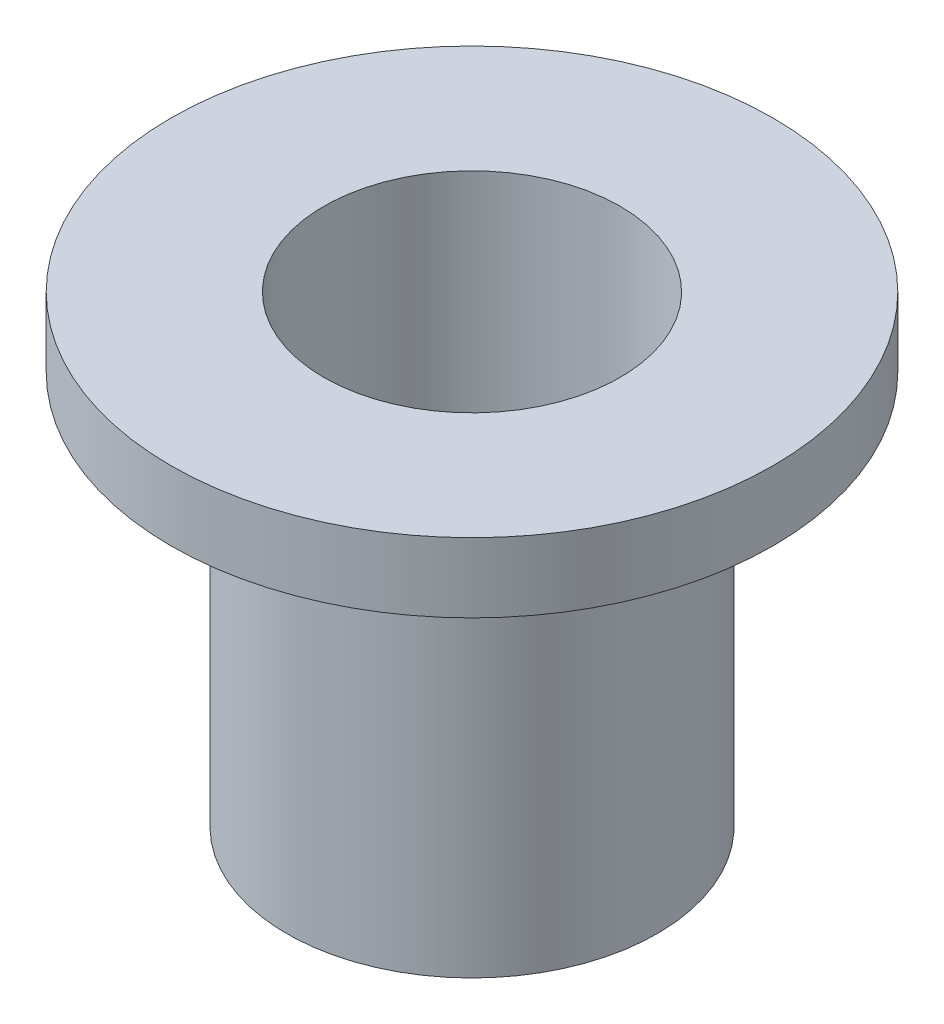
from build123d import *


with BuildPart() as part:
    # Эскиз1 → Повернуть1 (revolve)
    with BuildSketch(Plane(origin=(0, 0, 0), x_dir=(0, 0, -1), z_dir=(1, 0, 0)), mode=Mode.PRIVATE) as revolve_1_sk:
        Polygon((-3.2, 0), (-3.2, 10), (-6.5, 10), (-6.5, 8.5), (-4, 8.5), (-4, 0), align=None)
    revolve(revolve_1_sk.sketch.rotate(Axis((0, -11.988468529, 0), (0, 1, 0)), 180), axis=Axis((0, -11.988468529, 0), (0, 1, 0)))


solid = part.part
